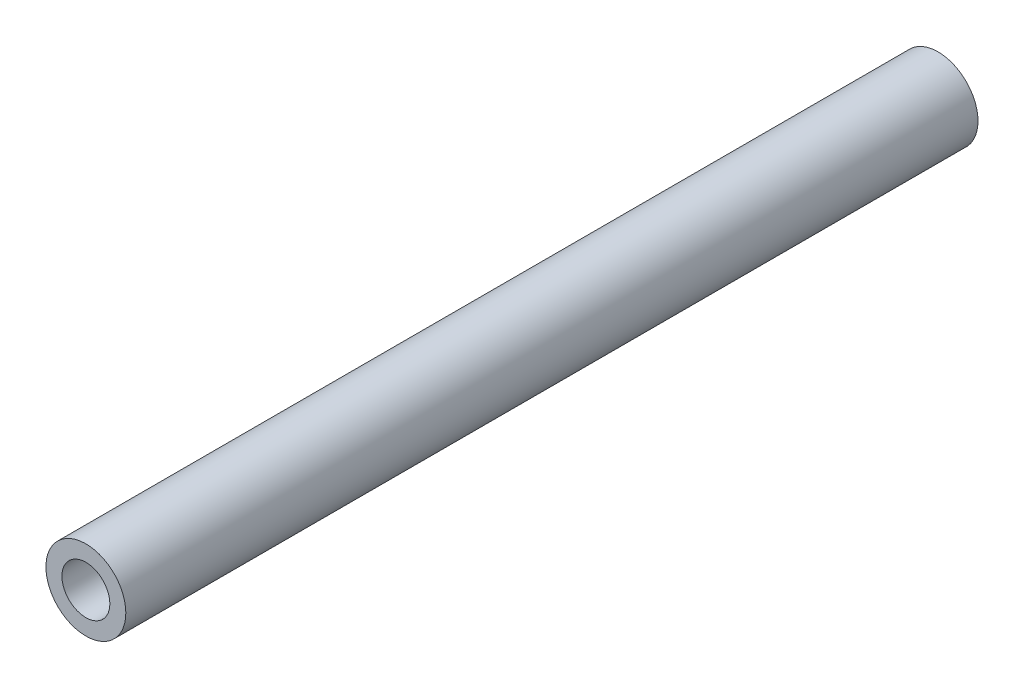
from build123d import *

# Parameters (mm, degrees)
SKETCH1_R           = 1.5
SKETCH1_R_2         = 0.9
BOSS_EXTRUDE1_DEPTH = 32


with BuildPart() as part:
    # Sketch1 → Boss-Extrude1 (new body)
    with BuildSketch(Plane.XY):
        Circle(SKETCH1_R)
        Circle(SKETCH1_R_2, mode=Mode.SUBTRACT)
    extrude(amount=BOSS_EXTRUDE1_DEPTH)


solid = part.part
